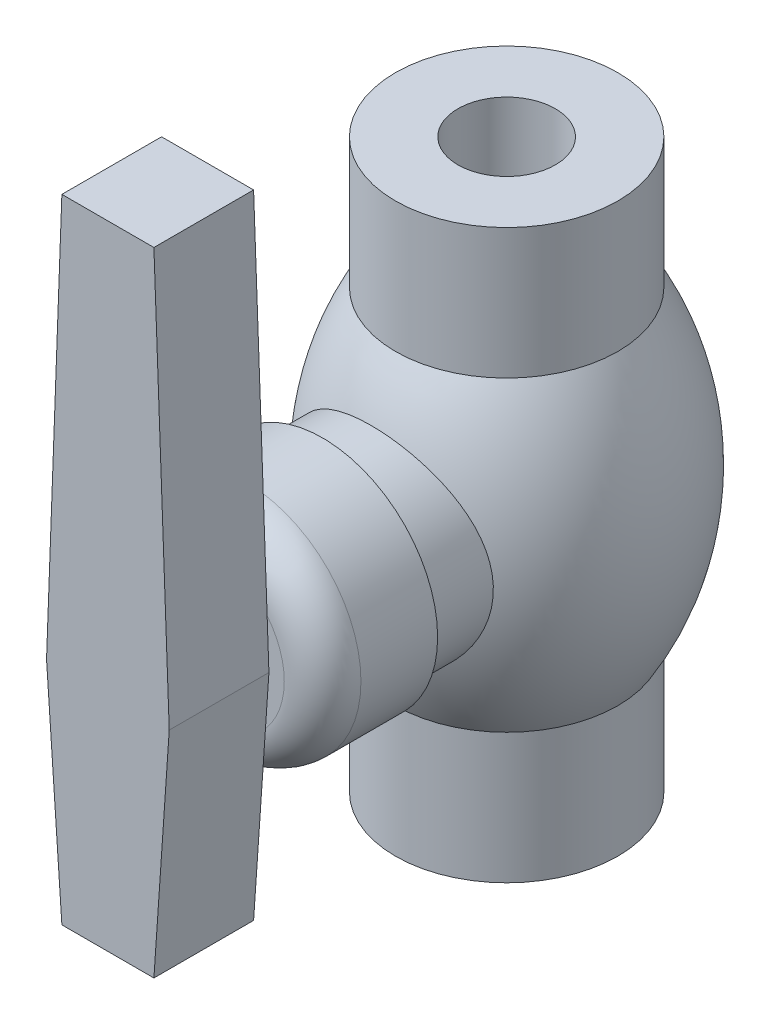
from build123d import *

# Parameters (mm, degrees)
CROQUIS2_R              = 6.35
CORTAR_EXTRUIR1_DEPTH   = 80.221209332
CROQUIS3_R              = 13.25
SALIENTE_EXTRUIR1_DEPTH = 24
CROQUIS4_R              = 6.35
CORTAR_EXTRUIR2_DEPTH   = 81.324342659
CROQUIS5_R              = 15
SALIENTE_EXTRUIR2_DEPTH = 15
REDONDEO1_R             = 5
SALIENTE_EXTRUIR3_DEPTH = 13


with BuildPart() as part:
    # Croquis1 → Revolución1 (revolve)
    with BuildSketch(Plane.XY, mode=Mode.PRIVATE) as revoluci_n1_sk:
        with BuildLine():
            Line((0, 0), (14.5, 0))
            Line((14.5, 0), (14.5, 17))
            ThreePointArc((14.5, 17), (20, 37), (14.5, 57))
            Line((14.5, 57), (14.5, 74))
            Line((14.5, 74), (0, 74))
            Line((0, 74), (0, 0))
        make_face()
    revolve(revoluci_n1_sk.sketch.rotate(Axis((0, 74, 0), (0, -1, 0)), 90), axis=Axis((0, 74, 0), (0, -1, 0)))

    # Croquis2 → Cortar-Extruir1 (cut, through all)
    with BuildSketch(Plane(origin=(0, 74, 0), x_dir=(1, 0, 0), z_dir=(0, 1, 0))):
        with Locations(Location((0, 0, 0), (0, 0, 270))):
            Circle(CROQUIS2_R)
    extrude(amount=-CORTAR_EXTRUIR1_DEPTH, mode=Mode.SUBTRACT)

    # Croquis3 → Saliente-Extruir1 (add)
    with BuildSketch(Plane.XY):
        with Locations(Location((0, 37, 0), (0, 0, 223.63840605))):
            Circle(CROQUIS3_R)
    extrude(amount=SALIENTE_EXTRUIR1_DEPTH)

    # Croquis4 → Cortar-Extruir2 (cut, through all)
    with BuildSketch(Plane(origin=(0, 74, 0), x_dir=(1, 0, 0), z_dir=(0, 1, 0))):
        with Locations(Location((0, 0, 0), (0, 0, 270))):
            Circle(CROQUIS4_R)
    extrude(amount=-CORTAR_EXTRUIR2_DEPTH, mode=Mode.SUBTRACT)

    # Croquis5 → Saliente-Extruir2 (add)
    with BuildSketch(Plane.XY.offset(24)):
        with Locations((0, 37)):
            Circle(CROQUIS5_R)
    extrude(amount=SALIENTE_EXTRUIR2_DEPTH)

    # Redondeo1
    redondeo1_edges = [part.edges().sort_by_distance(p)[0] for p in [
        (-15, 37, 39),
    ]]
    fillet(redondeo1_edges, radius=REDONDEO1_R)

    # Croquis7 → Saliente-Extruir3 (add)
    with BuildSketch(Plane.XY.offset(39)):
        Polygon((-6, 90.5), (6, 90.5), (8, 37), (6, 8), (-6, 8), (-8, 37), align=None)
    extrude(amount=SALIENTE_EXTRUIR3_DEPTH)


solid = part.part
